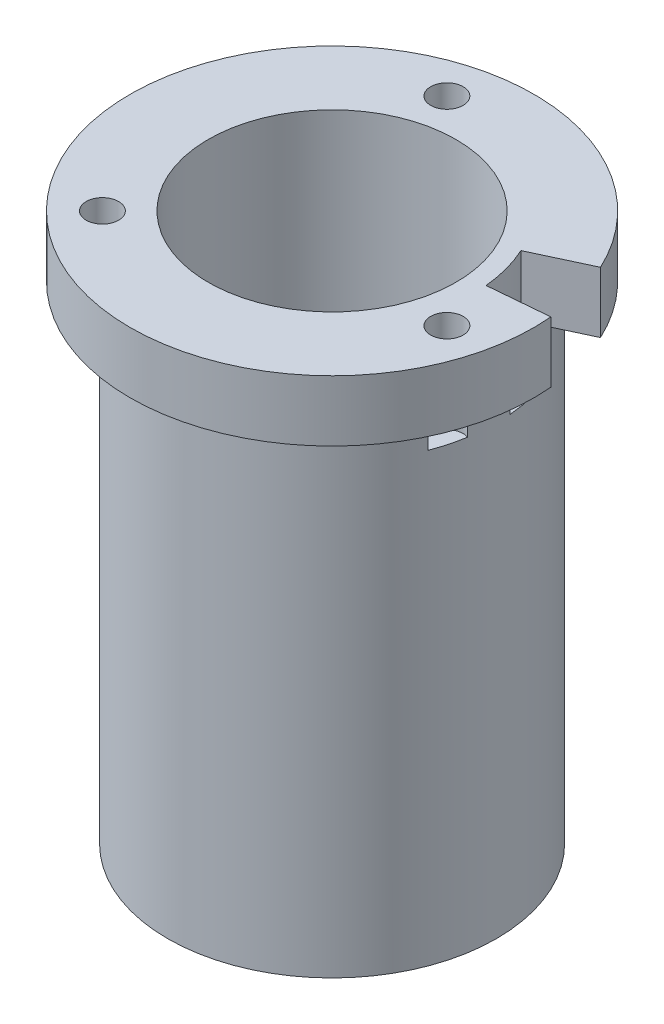
from build123d import *

# Parameters (mm, degrees)
SKETCH3_R          = 0.8
CUT_EXTRUDE1_DEPTH = 5


with BuildPart() as part:
    # Sketch2 → Revolve1 (revolve)
    with BuildSketch(Plane.XY, mode=Mode.PRIVATE) as revolve1_sk:
        Polygon((6.1, 0), (8.1, 0), (8.1, 24), (9.95, 24), (9.95, 27), (6.1, 27), align=None)
    revolve(revolve1_sk.sketch.rotate(Axis((0, 0, 0), (0, 1, 0)), 90), axis=Axis((0, 0, 0), (0, 1, 0)))

    # Sketch3 → Cut-Extrude1 (cut)
    with BuildSketch(Plane(origin=(0, 27, 0), x_dir=(1, 0, 0), z_dir=(0, 1, 0))):
        with Locations(Location((7.72740661, -2.070552361, 0), (0, 0, 270))):
            Circle(SKETCH3_R)
        with Locations(Location((-5.656854249, -5.656854249, 0), (0, 0, 270))):
            Circle(SKETCH3_R)
        with Locations(Location((-2.070552361, 7.72740661, 0), (0, 0, 270))):
            Circle(SKETCH3_R)
        with BuildLine():
            Line((6.344154509, 2.958327832), (9.06307787, 4.226182617))
            ThreePointArc((9.06307787, 4.226182617), (9.659258263, 2.588190451), (9.961946981, 0.871557427))
            Line((9.961946981, 0.871557427), (6.973362887, 0.610090199))
            ThreePointArc((6.973362887, 0.610090199), (6.761480784, 1.811733316), (6.344154509, 2.958327832))
        make_face()
    extrude(amount=-CUT_EXTRUDE1_DEPTH, mode=Mode.SUBTRACT)


solid = part.part
